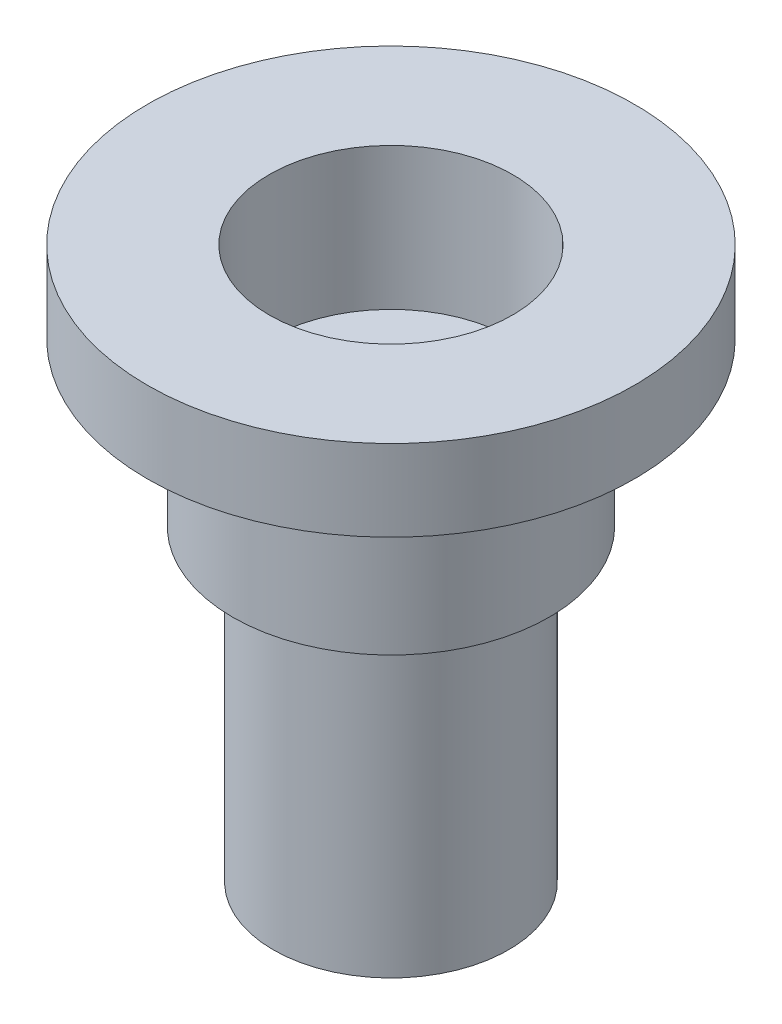
from build123d import *

# Parameters (mm, degrees)
SKETCH_1_R          = 3.9
EXTRUDE_1_DEPTH     = 4
SKETCH_2_R          = 6
EXTRUDE_2_DEPTH     = 2
SKETCH_6_R          = 2.9
EXTRUDE_3_DEPTH     = 7.6
SKETCH_3_R          = 1.6
CUT_EXTRUDE_1_DEPTH = 17.029971928
SKETCH_4_R          = 3
CUT_EXTRUDE_2_DEPTH = 3.5


with BuildPart() as part:
    # 草图1 → 凸台-拉伸1 (new body)
    with BuildSketch(Plane(origin=(0, 0, 0), x_dir=(1, 0, 0), z_dir=(0, 1, 0))):
        with Locations(Location((0, 0, 0), (0, 0, 270))):
            Circle(SKETCH_1_R)
    extrude(amount=EXTRUDE_1_DEPTH)

    # 草图2 → 凸台-拉伸2 (add)
    with BuildSketch(Plane(origin=(0, 4, 0), x_dir=(1, 0, 0), z_dir=(0, 1, 0))):
        with Locations(Location((0, 0, 0), (0, 0, 270))):
            Circle(SKETCH_2_R)
    extrude(amount=EXTRUDE_2_DEPTH)

    # 草图6 → 凸台-拉伸3 (add)
    with BuildSketch(Plane.XZ):
        with Locations(Location((0, 0, 0), (0, 0, 90))):
            Circle(SKETCH_6_R)
    extrude(amount=EXTRUDE_3_DEPTH)

    # 草图3 → 切除-拉伸1 (cut, through all)
    with BuildSketch(Plane(origin=(0, 6, 0), x_dir=(1, 0, 0), z_dir=(0, 1, 0))):
        with Locations(Location((0, 0, 0), (0, 0, 270))):
            Circle(SKETCH_3_R)
    extrude(amount=-CUT_EXTRUDE_1_DEPTH, mode=Mode.SUBTRACT)

    # 草图4 → 切除-拉伸2 (cut)
    with BuildSketch(Plane(origin=(0, 6, 0), x_dir=(1, 0, 0), z_dir=(0, 1, 0))):
        with Locations(Location((0, 0, 0), (0, 0, 270))):
            Circle(SKETCH_4_R)
    extrude(amount=-CUT_EXTRUDE_2_DEPTH, mode=Mode.SUBTRACT)


solid = part.part
